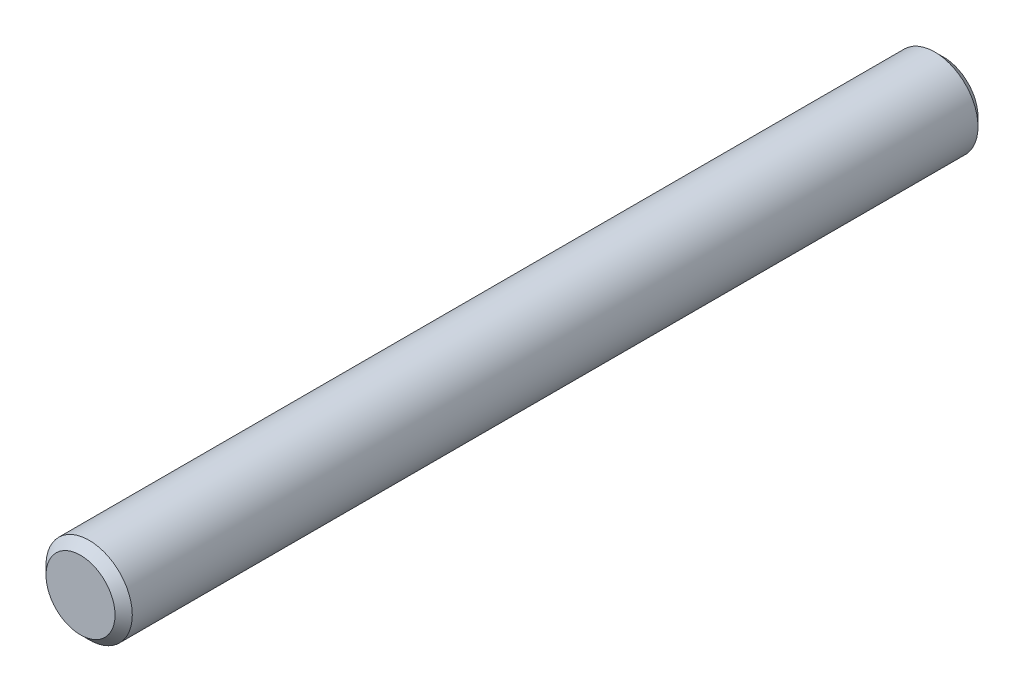
from build123d import *

# Parameters (mm, degrees)
SKETCH1_R      = 0.635
EXTRUDE1_DEPTH = 6.35
CHAMFER1_SIZE  = 0.127


with BuildPart() as part:
    # Sketch1 → Extrude1 (new, symmetric)
    with BuildSketch(Plane.XY):
        Circle(SKETCH1_R)
    extrude(amount=EXTRUDE1_DEPTH, both=True)

    # Chamfer1
    chamfer1_edges = [part.edges().sort_by_distance(p)[0] for p in [
        (-0.635, 0, -6.35),
        (-0.635, 0, 6.35),
    ]]
    chamfer(chamfer1_edges, length=CHAMFER1_SIZE)


solid = part.part
